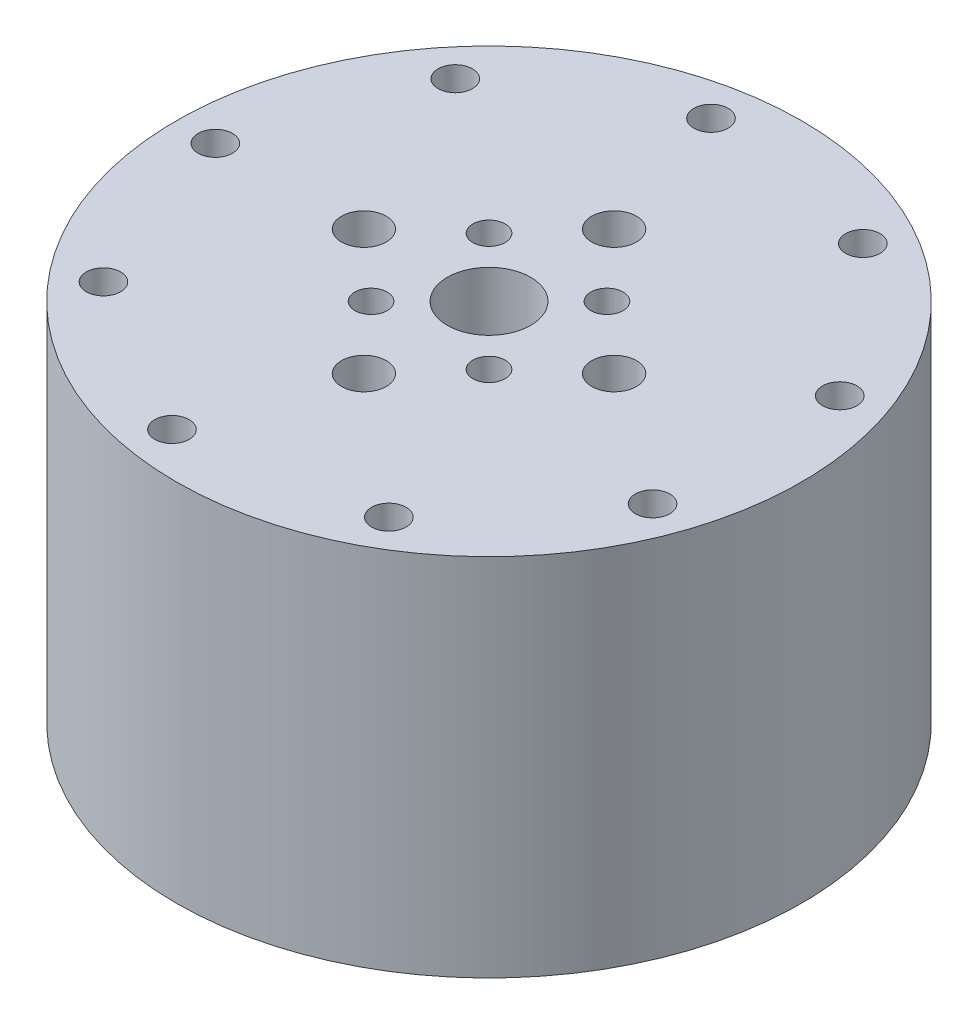
from build123d import *

# Parameters (mm, degrees)
SKETCH_1_R          = 30
EXTRUDE_1_DEPTH     = 35
SKETCH_2_R          = 1.65
CUT_EXTRUDE_1_DEPTH = 56
SKETCH_4_R          = 20
CUT_EXTRUDE_3_DEPTH = 10
SKETCH_5_R          = 4
CUT_EXTRUDE_4_DEPTH = 50.244289009
SKETCH_6_R          = 2.15
SKETCH_6_R_2        = 1.55
CUT_EXTRUDE_5_DEPTH = 50.244289009


with BuildPart() as part:
    # 草图1 → 凸台-拉伸1 (new body)
    with BuildSketch(Plane(origin=(0, 0, 0), x_dir=(1, 0, 0), z_dir=(0, 1, 0))):
        with Locations(Location((0, 0, 0), (0, 0, 270))):
            Circle(SKETCH_1_R)
    extrude(amount=EXTRUDE_1_DEPTH)

    # 草图2 → 切除-拉伸1 (cut, through all)
    with BuildSketch(Plane.XZ):
        with Locations(Location((-26.25, 0, 0), (0, 0, 270))):
            Circle(SKETCH_2_R)
        with Locations(Location((-20.108666632, 16.873174754, 0), (0, 0, 270))):
            Circle(SKETCH_2_R)
        with Locations(Location((-4.558264664, 25.851203517, 0), (0, 0, 270))):
            Circle(SKETCH_2_R)
        with Locations(Location((13.125, 22.733166849, 0), (0, 0, 270))):
            Circle(SKETCH_2_R)
        with Locations(Location((24.666931296, 8.978028762, 0), (0, 0, 270))):
            Circle(SKETCH_2_R)
        with Locations(Location((24.666931296, -8.978028762, 0), (0, 0, 270))):
            Circle(SKETCH_2_R)
        with Locations(Location((13.125, -22.733166849, 0), (0, 0, 270))):
            Circle(SKETCH_2_R)
        with Locations(Location((-4.558264664, -25.851203517, 0), (0, 0, 270))):
            Circle(SKETCH_2_R)
        with Locations(Location((-20.108666632, -16.873174754, 0), (0, 0, 270))):
            Circle(SKETCH_2_R)
    extrude(amount=-CUT_EXTRUDE_1_DEPTH, mode=Mode.SUBTRACT)

    # 草图4 → 切除-拉伸3 (cut)
    with BuildSketch(Plane.XZ):
        with Locations(Location((0, 0, 0), (0, 0, 270))):
            Circle(SKETCH_4_R)
    extrude(amount=-CUT_EXTRUDE_3_DEPTH, mode=Mode.SUBTRACT)

    # 草图5 → 切除-拉伸4 (cut, through all)
    with BuildSketch(Plane.XZ.offset(-10)):
        with Locations(Location((0, 0, 0), (0, 0, 270))):
            Circle(SKETCH_5_R)
    extrude(amount=-CUT_EXTRUDE_4_DEPTH, mode=Mode.SUBTRACT)

    # 草图6 → 切除-拉伸5 (cut, through all)
    with BuildSketch(Plane.XZ.offset(-10)):
        with Locations(Location((0, 12, 0), (0, 0, 270))):
            Circle(SKETCH_6_R)
        with Locations(Location((12, 0, 0), (0, 0, 270))):
            Circle(SKETCH_6_R)
        with Locations(Location((0, -12, 0), (0, 0, 270))):
            Circle(SKETCH_6_R)
        with Locations(Location((-12, 0, 0), (0, 0, 270))):
            Circle(SKETCH_6_R)
        with Locations(Location((-5.656854249, -5.656854249, 0), (0, 0, 270))):
            Circle(SKETCH_6_R_2)
        with Locations(Location((-5.656854249, 5.656854249, 0), (0, 0, 270))):
            Circle(SKETCH_6_R_2)
        with Locations(Location((5.656854249, 5.656854249, 0), (0, 0, 270))):
            Circle(SKETCH_6_R_2)
        with Locations(Location((5.656854249, -5.656854249, 0), (0, 0, 270))):
            Circle(SKETCH_6_R_2)
    extrude(amount=-CUT_EXTRUDE_5_DEPTH, mode=Mode.SUBTRACT)


solid = part.part
